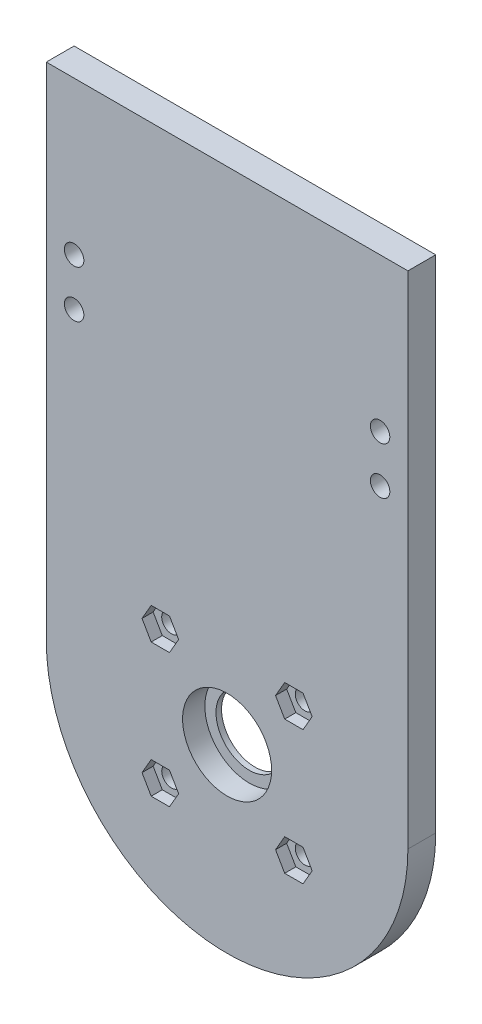
from build123d import *

# Parameters (mm, degrees)
BOSS_EXTRUDE1_DEPTH = 5
SKETCH2_R           = 6
CUT_EXTRUDE1_DEPTH  = 96.818839484
SKETCH3_R           = 8
CUT_EXTRUDE2_DEPTH  = 4
SKETCH4_R           = 1.75
CUT_EXTRUDE3_DEPTH  = 96.818839484
CUT_EXTRUDE4_DEPTH  = 2
SKETCH6_R           = 1.75
CUT_EXTRUDE5_DEPTH  = 96.818839484


with BuildPart() as part:
    # Sketch1 → Boss-Extrude1 (new body)
    with BuildSketch(Plane.XY):
        with BuildLine():
            Line((-32.5, 0), (-32.5, 90))
            Line((-32.5, 90), (32.5, 90))
            Line((32.5, 90), (32.5, 0))
            ThreePointArc((32.5, 0), (0, -32.5), (-32.5, 0))
        make_face()
    extrude(amount=BOSS_EXTRUDE1_DEPTH)

    # Sketch2 → Cut-Extrude1 (cut, through all)
    with BuildSketch(Plane.XY.offset(5)):
        Circle(SKETCH2_R)
    extrude(amount=-CUT_EXTRUDE1_DEPTH, mode=Mode.SUBTRACT)

    # Sketch3 → Cut-Extrude2 (cut)
    with BuildSketch(Plane.XY.offset(5)):
        Circle(SKETCH3_R)
    extrude(amount=-CUT_EXTRUDE2_DEPTH, mode=Mode.SUBTRACT)

    # Sketch4 → Cut-Extrude3 (cut, through all)
    with BuildSketch(Plane.XY.offset(5)):
        with Locations((-12, 12)):
            Circle(SKETCH4_R)
        with Locations(Location((12, 12, 0), (0, 0, 180))):
            Circle(SKETCH4_R)
        with Locations((12, -12)):
            Circle(SKETCH4_R)
        with Locations(Location((-12, -12, 0), (0, 0, 180))):
            Circle(SKETCH4_R)
    extrude(amount=-CUT_EXTRUDE3_DEPTH, mode=Mode.SUBTRACT)

    # Sketch5 → Cut-Extrude4 (cut)
    with BuildSketch(Plane.XY.offset(5)):
        Polygon((-8.709103466, 12), (-10.354551733, 14.85), (-13.645448267, 14.85), (-15.290896534, 12), (-13.645448267, 9.15), (-10.354551733, 9.15), align=None)
        Polygon((10.354551733, 9.15), (8.709103466, 12), (10.354551733, 14.85), (13.645448267, 14.85), (15.290896534, 12), (13.645448267, 9.15), align=None)
        Polygon((8.709103466, -12), (10.354551733, -14.85), (13.645448267, -14.85), (15.290896534, -12), (13.645448267, -9.15), (10.354551733, -9.15), align=None)
        Polygon((-10.354551733, -9.15), (-8.709103466, -12), (-10.354551733, -14.85), (-13.645448267, -14.85), (-15.290896534, -12), (-13.645448267, -9.15), align=None)
    extrude(amount=-CUT_EXTRUDE4_DEPTH, mode=Mode.SUBTRACT)

    # Sketch6 → Cut-Extrude5 (cut, through all)
    with BuildSketch(Plane.XY.offset(5)):
        with Locations((-27.5, 62.5)):
            Circle(SKETCH6_R)
        with Locations((-27.5, 54)):
            Circle(SKETCH6_R)
        with Locations(Location((27.5, 54, 0), (0, 0, 180))):
            Circle(SKETCH6_R)
        with Locations(Location((27.5, 62.5, 0), (0, 0, 180))):
            Circle(SKETCH6_R)
    extrude(amount=-CUT_EXTRUDE5_DEPTH, mode=Mode.SUBTRACT)


solid = part.part
